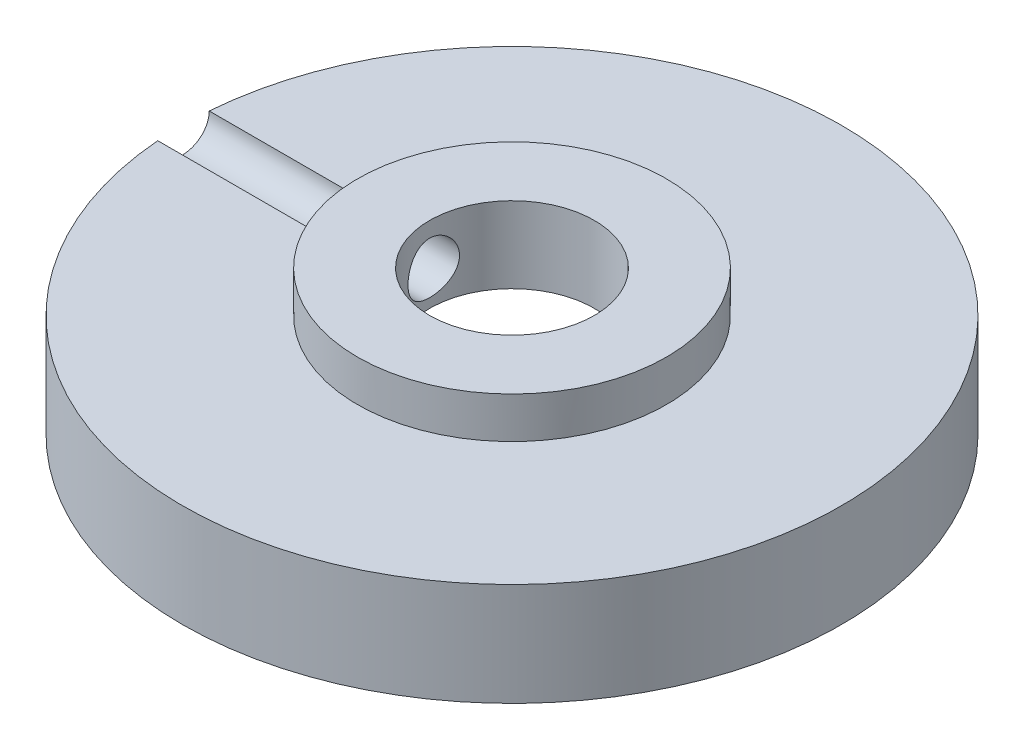
from build123d import *

# Parameters (mm, degrees)
SKETCH1_R           = 16
SKETCH1_W           = 2
SKETCH1_H           = 3
SKETCH1_R_2         = 10
BOSS_EXTRUDE3_DEPTH = 1
SKETCH2_R           = 16
SKETCH2_R_2         = 10
BOSS_EXTRUDE4_DEPTH = 1.5
SKETCH3_R           = 16
SKETCH3_R_2         = 10
BOSS_EXTRUDE5_DEPTH = 0.8
SKETCH4_R           = 16
BOSS_EXTRUDE6_DEPTH = 1.7
SKETCH5_R           = 4
CUT_EXTRUDE3_DEPTH  = 1.7
BOSS_EXTRUDE8_START = 2
SKETCH6_R           = 7.5
SKETCH6_R_2         = 4
BOSS_EXTRUDE8_DEPTH = 2
SKETCH8_R           = 1.25
CUT_EXTRUDE5_DEPTH  = 29


with BuildPart() as part:
    # Sketch1 → Boss-Extrude3 (new body)
    with BuildSketch(Plane(origin=(0, 0, 0), x_dir=(1, 0, 0), z_dir=(0, 1, 0))):
        with Locations(Location((0, 0, 0), (0, 0, 270))):
            Circle(SKETCH1_R)
        Polygon((3.992867118, 13.97522852), (3.369132045, 11.040785718), (1.412836844, 11.456609099), (2.036571916, 14.391051901), align=None, mode=Mode.SUBTRACT)
        with Locations((0, 13)):
            Rectangle(SKETCH1_W, SKETCH1_H, mode=Mode.SUBTRACT)
        Polygon((6.811226782, 12.839672493), (5.591016853, 10.09903612), (3.763925938, 10.912509406), (4.984135867, 13.653145779), align=None, mode=Mode.SUBTRACT)
        Polygon((-2.036571916, 14.391051901), (-1.412836844, 11.456609099), (-3.369132045, 11.040785718), (-3.992867118, 13.97522852), align=None, mode=Mode.SUBTRACT)
        Polygon((9.331903153, 11.142961166), (7.568547396, 8.715910183), (5.950513407, 9.891480688), (7.713869164, 12.318531671), align=None, mode=Mode.SUBTRACT)
        Polygon((-4.984135867, 13.653145779), (-3.763925938, 10.912509406), (-5.591016853, 10.09903612), (-6.811226782, 12.839672493), align=None, mode=Mode.SUBTRACT)
        Polygon((-9.331903153, -11.142961166), (-7.568547396, -8.715910183), (-5.950513407, -9.891480688), (-7.713869164, -12.318531671), align=None, mode=Mode.SUBTRACT)
        Polygon((-11.444730576, -8.959248967), (-9.215296099, -6.951857148), (-7.877034887, -8.438146799), (-10.106469363, -10.445538618), align=None, mode=Mode.SUBTRACT)
        Polygon((-6.811226782, -12.839672493), (-5.591016853, -10.09903612), (-3.763925938, -10.912509406), (-4.984135867, -13.653145779), align=None, mode=Mode.SUBTRACT)
        with Locations((0, -13)):
            Rectangle(SKETCH1_W, SKETCH1_H, mode=Mode.SUBTRACT)
        Polygon((-1.412836844, -11.456609099), (-2.036571916, -14.391051901), (-3.992867118, -13.97522852), (-3.369132045, -11.040785718), align=None, mode=Mode.SUBTRACT)
        Polygon((-13.057368355, -6.383974596), (-10.459292144, -4.883974596), (-9.459292144, -6.616025404), (-12.057368355, -8.116025404), align=None, mode=Mode.SUBTRACT)
        Polygon((-14.099336481, -3.529689902), (-11.246166932, -2.602638919), (-10.628132943, -4.504751952), (-13.481302492, -5.431802935), align=None, mode=Mode.SUBTRACT)
        Polygon((-14.525095946, -0.521140822), (-11.54153026, -0.207555432), (-11.332473333, -2.196599223), (-14.31603902, -2.510184613), align=None, mode=Mode.SUBTRACT)
        Polygon((2.036571916, -14.391051901), (1.412836844, -11.456609099), (3.369132045, -11.040785718), (3.992867118, -13.97522852), align=None, mode=Mode.SUBTRACT)
        Polygon((4.984135867, -13.653145779), (3.763925938, -10.912509406), (5.591016853, -10.09903612), (6.811226782, -12.839672493), align=None, mode=Mode.SUBTRACT)
        Polygon((7.713869164, -12.318531671), (5.950513407, -9.891480688), (7.568547396, -8.715910183), (9.331903153, -11.142961166), align=None, mode=Mode.SUBTRACT)
        Polygon((10.106469363, -10.445538618), (7.877034887, -8.438146799), (9.215296099, -6.951857148), (11.444730576, -8.959248967), align=None, mode=Mode.SUBTRACT)
        Polygon((12.057368355, -8.116025404), (9.459292144, -6.616025404), (10.459292144, -4.883974596), (13.057368355, -6.383974596), align=None, mode=Mode.SUBTRACT)
        Polygon((13.481302492, -5.431802935), (10.628132943, -4.504751952), (11.246166932, -2.602638919), (14.099336481, -3.529689902), align=None, mode=Mode.SUBTRACT)
        Polygon((14.31603902, -2.510184613), (11.332473333, -2.196599223), (11.54153026, -0.207555432), (14.525095946, -0.521140822), align=None, mode=Mode.SUBTRACT)
        Polygon((-14.31603902, 2.510184613), (-11.332473333, 2.196599223), (-11.54153026, 0.207555432), (-14.525095946, 0.521140822), align=None, mode=Mode.SUBTRACT)
        Polygon((-13.481302492, 5.431802935), (-10.628132943, 4.504751952), (-11.246166932, 2.602638919), (-14.099336481, 3.529689902), align=None, mode=Mode.SUBTRACT)
        with Locations(Location((0, 0, 0), (0, 0, 270))):
            Circle(SKETCH1_R_2, mode=Mode.SUBTRACT)
        Polygon((-12.057368355, 8.116025404), (-9.459292144, 6.616025404), (-10.459292144, 4.883974596), (-13.057368355, 6.383974596), align=None, mode=Mode.SUBTRACT)
        Polygon((-10.106469363, 10.445538618), (-7.877034887, 8.438146799), (-9.215296099, 6.951857148), (-11.444730576, 8.959248967), align=None, mode=Mode.SUBTRACT)
        Polygon((-7.713869164, 12.318531671), (-5.950513407, 9.891480688), (-7.568547396, 8.715910183), (-9.331903153, 11.142961166), align=None, mode=Mode.SUBTRACT)
        Polygon((14.525095946, 0.521140822), (11.54153026, 0.207555432), (11.332473333, 2.196599223), (14.31603902, 2.510184613), align=None, mode=Mode.SUBTRACT)
        Polygon((14.099336481, 3.529689902), (11.246166932, 2.602638919), (10.628132943, 4.504751952), (13.481302492, 5.431802935), align=None, mode=Mode.SUBTRACT)
        Polygon((7.877034887, 8.438146799), (10.106469363, 10.445538618), (11.444730576, 8.959248967), (9.215296099, 6.951857148), align=None, mode=Mode.SUBTRACT)
        Polygon((13.057368355, 6.383974596), (10.459292144, 4.883974596), (9.459292144, 6.616025404), (12.057368355, 8.116025404), align=None, mode=Mode.SUBTRACT)
    extrude(amount=BOSS_EXTRUDE3_DEPTH)

    # Sketch2 → Boss-Extrude4 (add)
    with BuildSketch(Plane(origin=(0, 1, 0), x_dir=(1, 0, 0), z_dir=(0, 1, 0))):
        with Locations(Location((0, 0, 0), (0, 0, 270))):
            Circle(SKETCH2_R)
        with Locations(Location((0, 0, 0), (0, 0, 270))):
            Circle(SKETCH2_R_2, mode=Mode.SUBTRACT)
    extrude(amount=BOSS_EXTRUDE4_DEPTH)

    # Sketch3 → Boss-Extrude5 (add)
    with BuildSketch(Plane(origin=(0, 2.5, 0), x_dir=(1, 0, 0), z_dir=(0, 1, 0))):
        with Locations(Location((0, 0, 0), (0, 0, 270))):
            Circle(SKETCH3_R)
        with Locations(Location((0, 0, 0), (0, 0, 270))):
            Circle(SKETCH3_R_2, mode=Mode.SUBTRACT)
    extrude(amount=BOSS_EXTRUDE5_DEPTH)

    # Sketch4 → Boss-Extrude6 (add)
    with BuildSketch(Plane(origin=(0, 3.3, 0), x_dir=(1, 0, 0), z_dir=(0, 1, 0))):
        with Locations(Location((0, 0, 0), (0, 0, 270))):
            Circle(SKETCH4_R)
    extrude(amount=BOSS_EXTRUDE6_DEPTH)

    # Sketch5 → Cut-Extrude3 (cut)
    with BuildSketch(Plane(origin=(0, 5, 0), x_dir=(1, 0, 0), z_dir=(0, 1, 0))):
        with Locations(Location((0, 0, 0), (0, 0, 270))):
            Circle(SKETCH5_R)
    extrude(amount=-CUT_EXTRUDE3_DEPTH, mode=Mode.SUBTRACT)

    # Sketch6 → Boss-Extrude8 (add)
    with BuildSketch(Plane(origin=(0, 5, 0), x_dir=(1, 0, 0), z_dir=(0, 1, 0)).offset(BOSS_EXTRUDE8_START)):
        with Locations(Location((0, 0, 0), (0, 0, 270))):
            Circle(SKETCH6_R)
        with Locations(Location((0, 0, 0), (0, 0, 270))):
            Circle(SKETCH6_R_2, mode=Mode.SUBTRACT)
    extrude(amount=-BOSS_EXTRUDE8_DEPTH)

    # Sketch8 → Cut-Extrude5 (cut)
    with BuildSketch(Plane(origin=(0, 0, 0), x_dir=(0, 0, -1), z_dir=(1, 0, 0))):
        with Locations((0, 5)):
            Circle(SKETCH8_R)
    extrude(amount=-CUT_EXTRUDE5_DEPTH, mode=Mode.SUBTRACT)


solid = part.part
